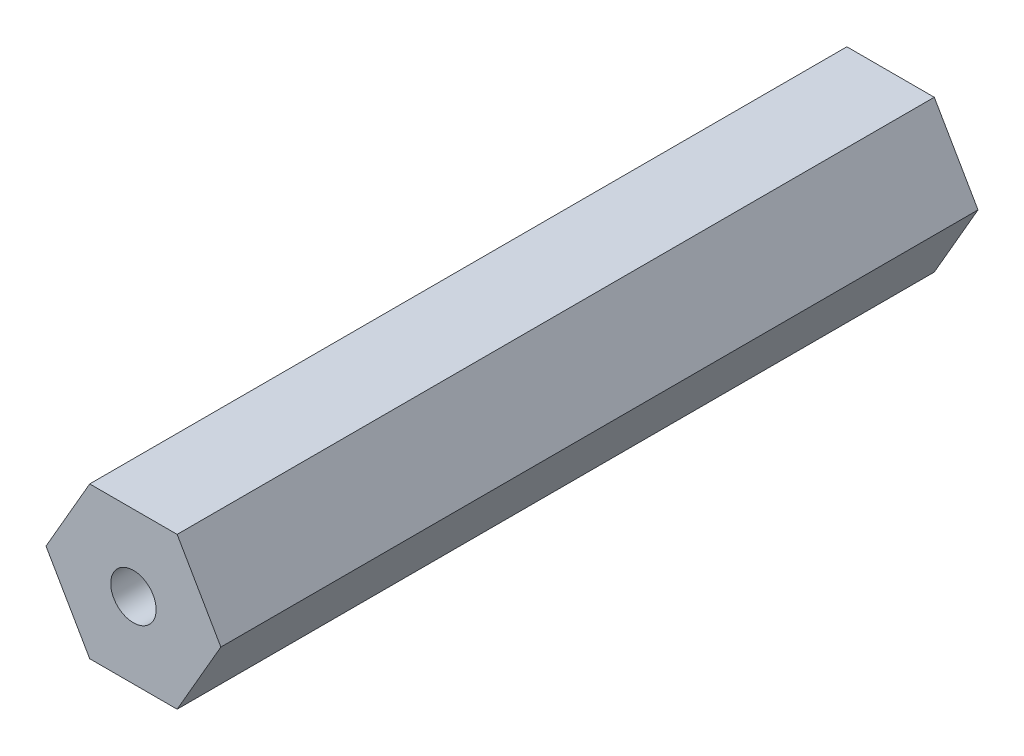
from build123d import *

# Parameters (mm, degrees)
SKETCH1_R           = 1.5
BOSS_EXTRUDE1_DEPTH = 50


with BuildPart() as part:
    # Sketch1 → Boss-Extrude1 (new body)
    with BuildSketch(Plane.XY):
        Polygon((5.773502692, 0), (2.886751346, 5), (-2.886751346, 5), (-5.773502692, 0), (-2.886751346, -5), (2.886751346, -5), align=None)
        Circle(SKETCH1_R, mode=Mode.SUBTRACT)
    extrude(amount=BOSS_EXTRUDE1_DEPTH)


solid = part.part
